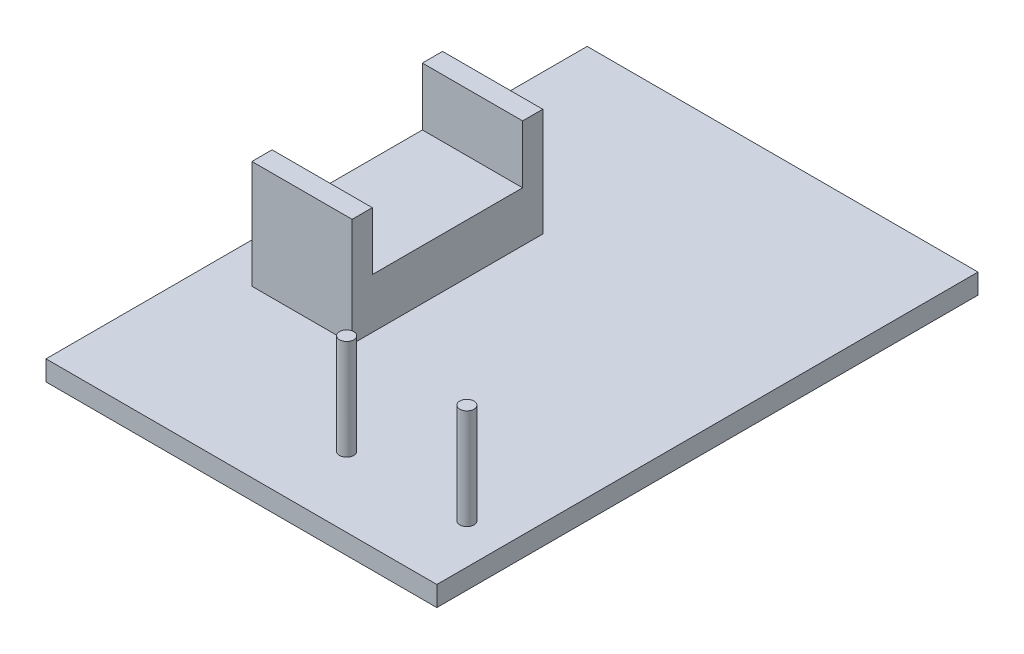
from build123d import *

# Parameters (mm, degrees)
SKETCH1_W           = 49.53
SKETCH1_H           = 68.58
BOSS_EXTRUDE1_DEPTH = 2.54
SKETCH3_R           = 0.9
BOSS_EXTRUDE3_DEPTH = 12.7
BOSS_EXTRUDE4_START = -5.08
BOSS_EXTRUDE4_DEPTH = 12.7


with BuildPart() as part:
    # Sketch1 → Boss-Extrude1 (new body)
    with BuildSketch(Plane(origin=(0, 0, 0), x_dir=(1, 0, 0), z_dir=(0, 1, 0))):
        Rectangle(SKETCH1_W, SKETCH1_H)
    extrude(amount=BOSS_EXTRUDE1_DEPTH)

    # Sketch3 → Boss-Extrude3 (add)
    with BuildSketch(Plane(origin=(0, 2.54, 0), x_dir=(1, 0, 0), z_dir=(0, 1, 0))):
        with Locations(Location((4.445, -25.4, 0), (0, 0, 90))):
            Circle(SKETCH3_R)
        with Locations(Location((19.685, -25.4, 0), (0, 0, 90))):
            Circle(SKETCH3_R)
    extrude(amount=BOSS_EXTRUDE3_DEPTH)

    # Sketch4 → Boss-Extrude4 (add)
    with BuildSketch(Plane.ZY.offset(24.765).offset(BOSS_EXTRUDE4_START)):
        Polygon((-10.882960378, 2.54), (-10.882960378, 16.234305586), (-8.32780624, 16.234305586), (-8.32780624, 8.89), (10.72219376, 8.89), (10.72219376, 16.234305586), (13.277347899, 16.234305586), (13.277347899, 2.54), align=None)
    extrude(amount=-BOSS_EXTRUDE4_DEPTH)


solid = part.part
